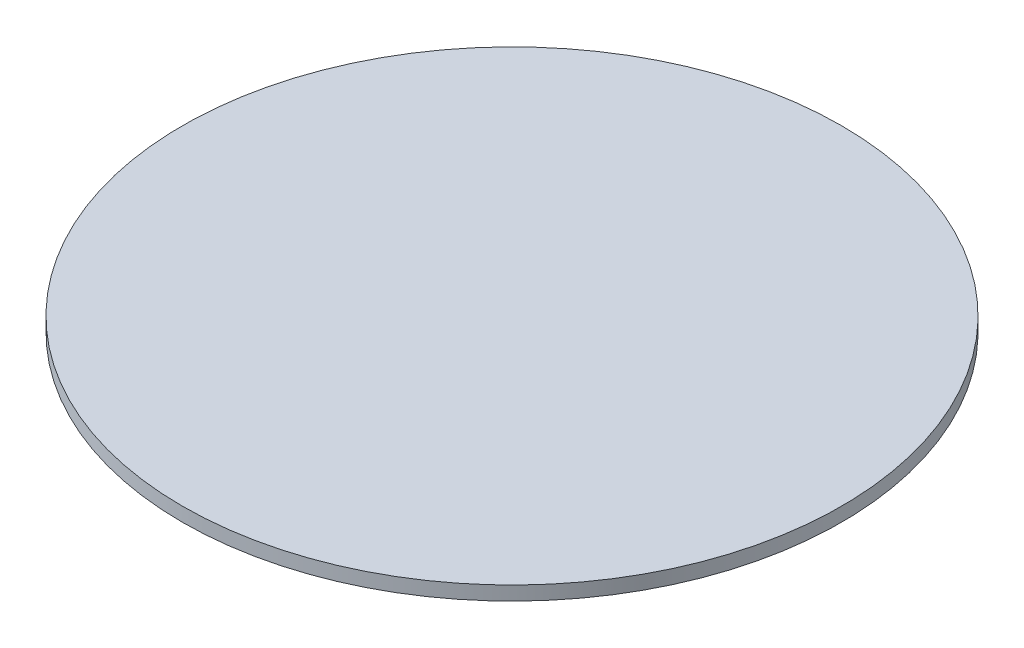
from build123d import *

# Parameters (mm, degrees)
SKETCH1_R           = 75
BOSS_EXTRUDE1_DEPTH = 3.175


with BuildPart() as part:
    # Sketch1 → Boss-Extrude1 (new body)
    with BuildSketch(Plane(origin=(0, 0, 0), x_dir=(1, 0, 0), z_dir=(0, 1, 0))):
        with Locations(Location((0, 0, 0), (0, 0, 270))):
            Circle(SKETCH1_R)
    extrude(amount=BOSS_EXTRUDE1_DEPTH)


solid = part.part
